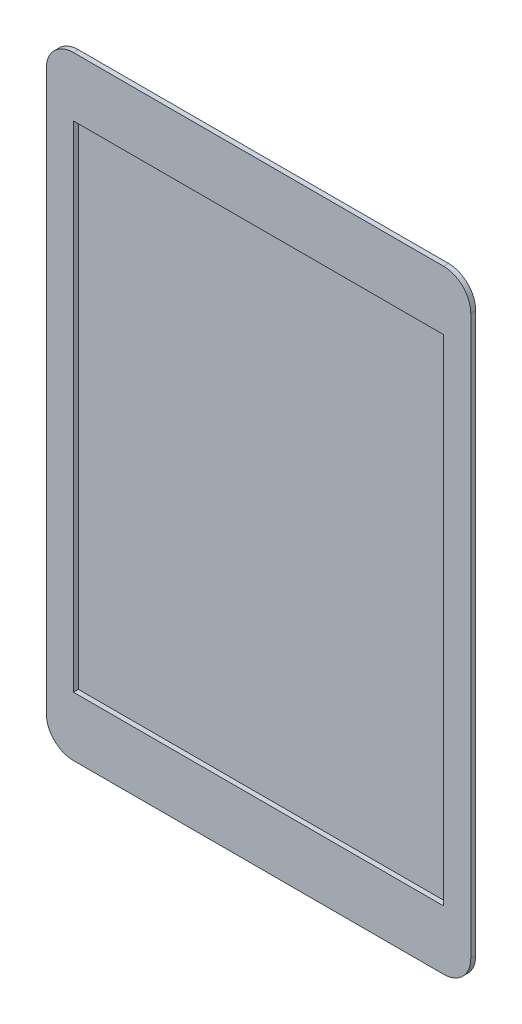
from build123d import *

# Parameters (mm, degrees)
SKETCH2_W           = 150.1
SKETCH2_H           = 200.6
BOSS_EXTRUDE1_DEPTH = 2
SKETCH3_W           = 150.1
SKETCH3_H           = 200.6
BOSS_EXTRUDE2_DEPTH = 0.1
SKETCH4_R           = 5.5
SKETCH4_R_2         = 4.75
CUT_EXTRUDE1_DEPTH  = 1
FILLET1_R           = 0.001
FILLET2_R           = 0.001
FILLET3_R           = 0.001
FILLET4_R           = 0.001
SKETCH5_R           = 1.5
CUT_EXTRUDE3_DEPTH  = 0.5


with BuildPart() as part:
    # Sketch2 → Boss-Extrude1 (new body)
    with BuildSketch(Plane.XY):
        with BuildLine():
            Line((-75.05, 124.3), (75.05, 124.3))
            ThreePointArc((75.05, 124.3), (82.828174593, 121.078174593), (86.05, 113.3))
            Line((86.05, 113.3), (86.05, -113.3))
            ThreePointArc((86.05, -113.3), (82.828174593, -121.078174593), (75.05, -124.3))
            Line((75.05, -124.3), (-75.05, -124.3))
            ThreePointArc((-75.05, -124.3), (-82.828174593, -121.078174593), (-86.05, -113.3))
            Line((-86.05, -113.3), (-86.05, 113.3))
            ThreePointArc((-86.05, 113.3), (-82.828174593, 121.078174593), (-75.05, 124.3))
        make_face()
        Rectangle(SKETCH2_W, SKETCH2_H, mode=Mode.SUBTRACT)
    extrude(amount=BOSS_EXTRUDE1_DEPTH)

    # Sketch4 → Cut-Extrude1 (cut)
    with BuildSketch(Plane(origin=(0, 0, 0), x_dir=(-1, 0, 0), z_dir=(0, 0, -1))):
        with Locations((0, -111.8)):
            Circle(SKETCH4_R)
        with Locations((0, -111.8)):
            Circle(SKETCH4_R_2, mode=Mode.SUBTRACT)
    extrude(amount=-CUT_EXTRUDE1_DEPTH, mode=Mode.SUBTRACT)

    # Fillet1
    fillet1_edges = [part.edges().sort_by_distance(p)[0] for p in [
        (4.75, -111.8, 0),
    ]]
    fillet(fillet1_edges, radius=FILLET1_R)

    # Fillet2
    fillet2_edges = [part.edges().sort_by_distance(p)[0] for p in [
        (5.5, -111.8, 0),
    ]]
    fillet(fillet2_edges, radius=FILLET2_R)

    # Fillet3
    fillet3_edges = [part.edges().sort_by_distance(p)[0] for p in [
        (5.5, -111.8, 1),
    ]]
    fillet(fillet3_edges, radius=FILLET3_R)

    # Fillet4
    fillet4_edges = [part.edges().sort_by_distance(p)[0] for p in [
        (4.75, -111.8, 1),
    ]]
    fillet(fillet4_edges, radius=FILLET4_R)

    # Sketch5 → Cut-Extrude3 (cut)
    with BuildSketch(Plane(origin=(0, 0, 0), x_dir=(-1, 0, 0), z_dir=(0, 0, -1))):
        with Locations((0, 112.859757772)):
            Circle(SKETCH5_R)
    extrude(amount=-CUT_EXTRUDE3_DEPTH, mode=Mode.SUBTRACT)


with BuildPart() as body_2:
    # Sketch3 → Boss-Extrude2 (new body)
    with BuildSketch(Plane.XY):
        Rectangle(SKETCH3_W, SKETCH3_H)
    extrude(amount=-BOSS_EXTRUDE2_DEPTH)


solid = Compound([part.part, body_2.part])
